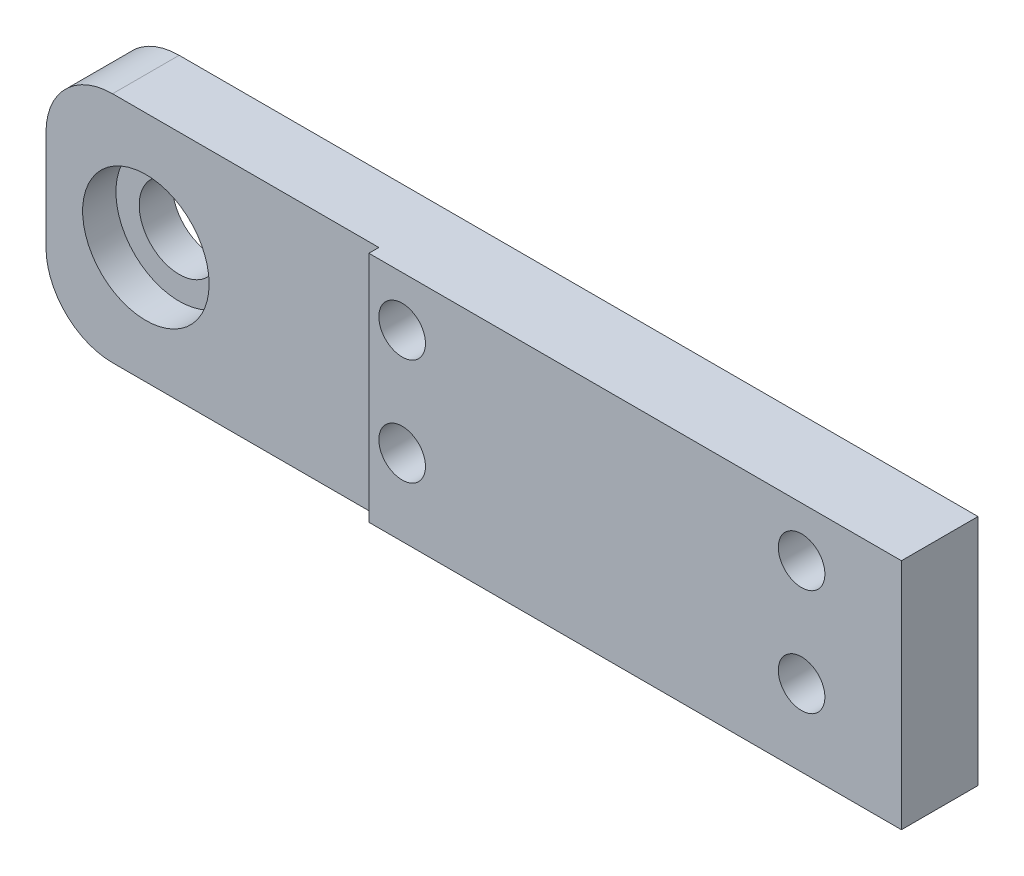
from build123d import *

# Parameters (mm, degrees)
SKETCH_1_W                   = 130
SKETCH_1_H                   = 35
EXTRUDE_1_DEPTH              = 10
SKETCH_2_R                   = 9.5
CUT_EXTRUDE_1_DEPTH          = 5
SKETCH_3_R                   = 6
CUT_EXTRUDE_2_DEPTH          = 135.721935853
FILLET_1_R                   = 10
SKETCH_4_W                   = 80
SKETCH_4_H                   = 35
EXTRUDE_2_DEPTH              = 1.5
HOLE_WIZARD_M6_1_D           = 7
HOLE_WIZARD_M6_1_CBORE_D     = 11
HOLE_WIZARD_M6_1_CBORE_DEPTH = 6


with BuildPart() as part:
    # 草图1 → 凸台-拉伸1 (new body)
    with BuildSketch(Plane.XY):
        with Locations((65, 17.5)):
            Rectangle(SKETCH_1_W, SKETCH_1_H)
    extrude(amount=EXTRUDE_1_DEPTH)

    # 草图2 → 切除-拉伸1 (cut)
    with BuildSketch(Plane.XY.offset(10)):
        with Locations((15, 17.5)):
            Circle(SKETCH_2_R)
    extrude(amount=-CUT_EXTRUDE_1_DEPTH, mode=Mode.SUBTRACT)

    # 草图3 → 切除-拉伸2 (cut, through all)
    with BuildSketch(Plane.XY.offset(5)):
        with Locations((15, 17.5)):
            Circle(SKETCH_3_R)
    extrude(amount=-CUT_EXTRUDE_2_DEPTH, mode=Mode.SUBTRACT)

    # 圆角1
    fillet_1_edges = [part.edges().sort_by_distance(p)[0] for p in [
        (0, 35, 5),
        (0, 0, 5),
    ]]
    fillet(fillet_1_edges, radius=FILLET_1_R)

    # 草图4 → 凸台-拉伸2 (add)
    with BuildSketch(Plane.XY.offset(10)):
        with Locations((90, 17.5)):
            Rectangle(SKETCH_4_W, SKETCH_4_H)
    extrude(amount=EXTRUDE_2_DEPTH)

    # M6 六角凹头螺钉的柱形沉头孔1 (through all)
    with Locations(Plane(origin=(0, 0, 0), x_dir=(-1, 0, 0), z_dir=(0, 0, -1))):
        with Locations((-115, 11.5), (-115, 27.5), (-55, 27.5), (-55, 11.5)):
            CounterBoreHole(HOLE_WIZARD_M6_1_D / 2, HOLE_WIZARD_M6_1_CBORE_D / 2, HOLE_WIZARD_M6_1_CBORE_DEPTH)


solid = part.part
